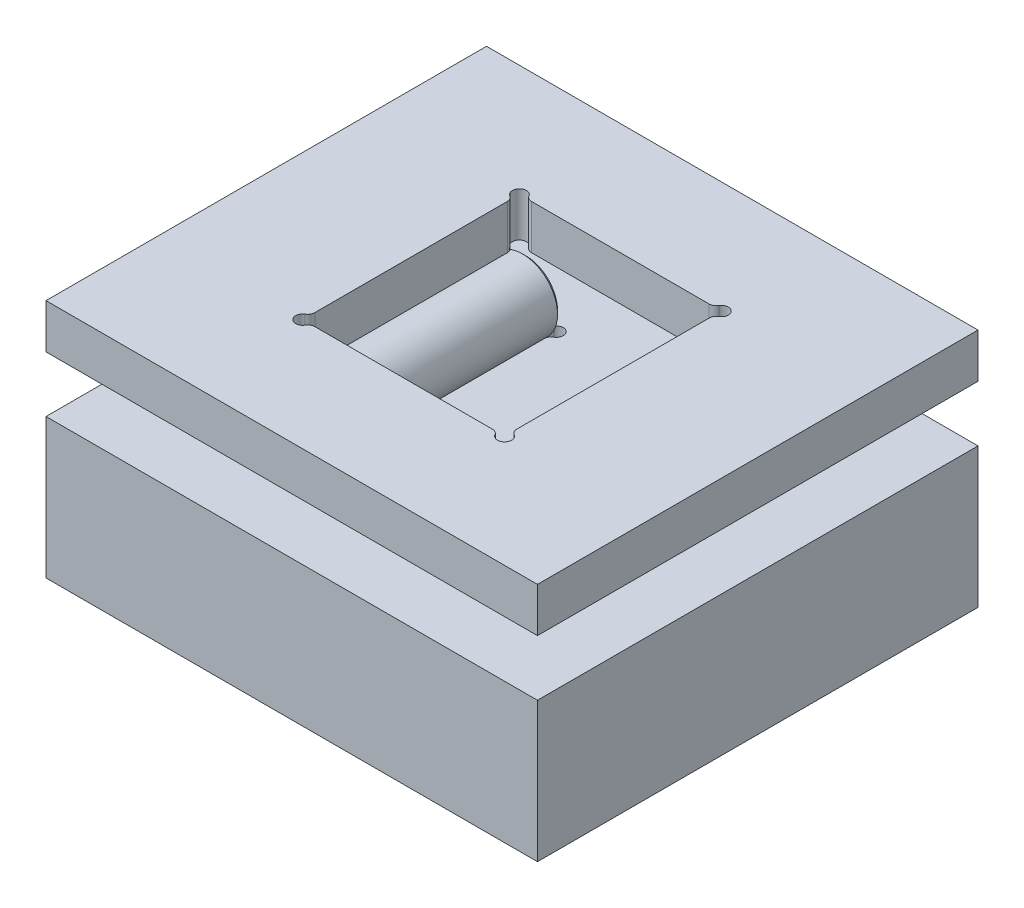
from build123d import *

# Parameters (mm, degrees)
SKETCH1_W             = 9.160158842
SKETCH1_H             = 10
BOSS_EXTRUDE1_DEPTH   = 7.75
SKETCH1_W_2           = 9.160158841
BOSS_EXTRUDE1_2_DEPTH = 7.75
BOSS_EXTRUDE1_3_DEPTH = 7.75
SKETCH1_W_3           = 10.351804159
SKETCH1_H_2           = 3.175
BOSS_EXTRUDE1_4_DEPTH = 7.75
BOSS_EXTRUDE1_5_DEPTH = 7.75
SKETCH2_W             = 35.140920954
SKETCH2_H             = 10
SKETCH2_H_2           = 3.175
BOSS_EXTRUDE2_DEPTH   = 8
SKETCH3_R             = 0.5
CUT_EXTRUDE1_DEPTH    = 26.627789241
SKETCH4_R             = 0.5
CUT_EXTRUDE2_DEPTH    = 3.175
FILLET1_R             = 0.5
FILLET2_R             = 0.5
SKETCH1_3_R           = 2.5
BOSS_EXTRUDE3_DEPTH   = 7.5
BOSS_EXTRUDE3_2_DEPTH = 7.5
CHAMFER1_SIZE         = 0.25
CHAMFER2_SIZE         = 0.25


with BuildPart() as part:
    # Sketch1 → Boss-Extrude1 (new body)
    with BuildSketch(Plane.XY):
        with Locations((0, -10.356969024)):
            Rectangle(SKETCH1_W, SKETCH1_H)
    extrude(amount=BOSS_EXTRUDE1_DEPTH)



with BuildPart() as body_2:
    # Sketch1 → Boss-Extrude1 2 (new body)
    with BuildSketch(Plane.XY):
        with Locations((12.990381057, -10.356969024)):
            Rectangle(SKETCH1_W_2, SKETCH1_H)
    extrude(amount=BOSS_EXTRUDE1_2_DEPTH)


with BuildPart() as body_3:
    # Sketch1 → Boss-Extrude1 3 (new body)
    with BuildSketch(Plane.XY):
        with Locations((-12.990381057, -10.356969024)):
            Rectangle(SKETCH1_W_2, SKETCH1_H)
    extrude(amount=BOSS_EXTRUDE1_3_DEPTH)


with BuildPart() as body_4:
    # Sketch1 → Boss-Extrude1 4 (new body)
    with BuildSketch(Plane.XY):
        with Locations((-12.394558398, 0.230530976)):
            Rectangle(SKETCH1_W_3, SKETCH1_H_2)
    extrude(amount=BOSS_EXTRUDE1_4_DEPTH)


with BuildPart() as body_5:
    # Sketch1 → Boss-Extrude1 5 (new body)
    with BuildSketch(Plane.XY):
        with Locations((12.394558398, 0.230530976)):
            Rectangle(SKETCH1_W_3, SKETCH1_H_2)
    extrude(amount=BOSS_EXTRUDE1_5_DEPTH)


with BuildPart() as part_1:
    add(part.part)

    add(body_2.part)  # Boss-Extrude2 merges body 2

    add(body_3.part)  # Boss-Extrude2 merges body 3

    add(body_4.part)  # Boss-Extrude2 merges body 4

    add(body_5.part)  # Boss-Extrude2 merges body 5
    # Sketch2 → Boss-Extrude2 (add)
    with BuildSketch(Plane.XY.offset(7.75)):
        with Locations((0, -10.356969024)):
            Rectangle(SKETCH2_W, SKETCH2_H)
        with Locations((0, 0.230530976)):
            Rectangle(SKETCH2_W, SKETCH2_H_2)
    extrude(amount=BOSS_EXTRUDE2_DEPTH)

    # Sketch3 → Cut-Extrude1 (cut, through all)
    with BuildSketch(Plane(origin=(0, -5.356969024, 0), x_dir=(1, 0, 0), z_dir=(0, 1, 0))):
        with Locations((-8.410301636, -7.75)):
            Circle(SKETCH3_R)
        with Locations((-4.580079421, -7.75)):
            Circle(SKETCH3_R)
        with Locations((4.580079421, -7.75)):
            Circle(SKETCH3_R)
        with Locations((8.410301636, -7.75)):
            Circle(SKETCH3_R)
    extrude(amount=-CUT_EXTRUDE1_DEPTH, mode=Mode.SUBTRACT)

    # Sketch4 → Cut-Extrude2 (cut)
    with BuildSketch(Plane(origin=(0, 1.818030976, 0), x_dir=(1, 0, 0), z_dir=(0, 1, 0))):
        with Locations((-7.218656318, -7.75)):
            Circle(SKETCH4_R)
        with Locations((7.218656318, -7.75)):
            Circle(SKETCH4_R)
    extrude(amount=-CUT_EXTRUDE2_DEPTH, mode=Mode.SUBTRACT)

    # Fillet1
    fillet1_edges = [part_1.edges().sort_by_distance(p)[0] for p in [
        (-7.910301636, -10.356969024, 7.75),
        (-4.580079421, -10.356969024, 7.25),
        (5.080079421, -10.356969024, 7.75),
        (4.580079421, -10.356969024, 7.25),
        (7.910301636, -10.356969024, 7.75),
        (-8.410301636, -10.356969024, 7.25),
        (8.410301636, -10.356969024, 7.25),
        (-5.080079421, -10.356969024, 7.75),
    ]]
    fillet(fillet1_edges, radius=FILLET1_R)

    # Fillet2
    fillet2_edges = [part_1.edges().sort_by_distance(p)[0] for p in [
        (7.218656318, 0.230530976, 7.25),
        (-7.218656318, 0.230530976, 7.25),
        (-6.718656318, 0.230530976, 7.75),
        (6.718656318, 0.230530976, 7.75),
    ]]
    fillet(fillet2_edges, radius=FILLET2_R)

    # Mirror1: part across plane


with BuildPart() as part_2:
    add(part_1.part)
    add(part_1.part.mirror(Plane(origin=(0, 0, 0), x_dir=(1, 0, 0), z_dir=(0, 0, -1))))


with BuildPart() as body_2_2:
    # Sketch1<3> → Boss-Extrude3 (new, symmetric)
    with BuildSketch(Plane.XY):
        with Locations((6.495190528, -3.75)):
            Circle(SKETCH1_3_R)
    extrude(amount=BOSS_EXTRUDE3_DEPTH, both=True)

    # Chamfer2
    chamfer2_edges = [body_2_2.edges().sort_by_distance(p)[0] for p in [
        (3.995190528, -3.75, -7.5),
        (3.995190528, -3.75, 7.5),
    ]]
    chamfer(chamfer2_edges, length=CHAMFER2_SIZE)


with BuildPart() as body_3_2:
    # Sketch1<3> → Boss-Extrude3 2 (new, symmetric)
    with BuildSketch(Plane.XY):
        with Locations((-6.495190528, -3.75)):
            Circle(SKETCH1_3_R)
    extrude(amount=BOSS_EXTRUDE3_2_DEPTH, both=True)

    # Chamfer1
    chamfer1_edges = [body_3_2.edges().sort_by_distance(p)[0] for p in [
        (-8.995190528, -3.75, -7.5),
        (-8.995190528, -3.75, 7.5),
    ]]
    chamfer(chamfer1_edges, length=CHAMFER1_SIZE)


solid = Compound([part_2.part, body_2_2.part, body_3_2.part])
